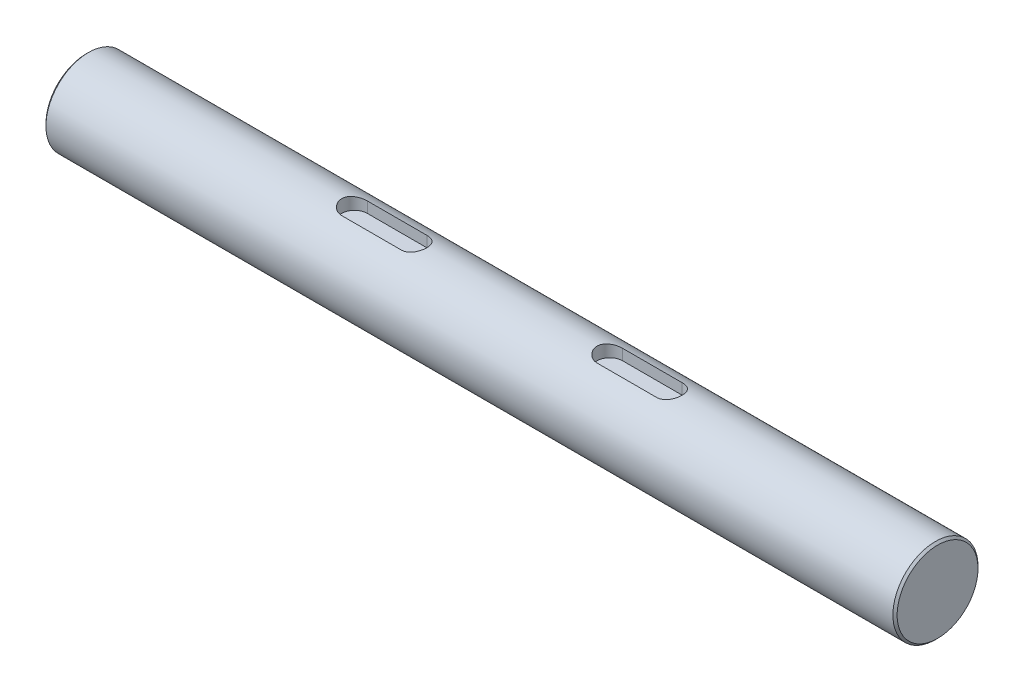
from build123d import *

# Parameters (mm, degrees)
SKETCH_1_R          = 10
EXTRUDE_1_DEPTH     = 100
CUT_EXTRUDE_1_DEPTH = 3
CHAMFER_1_SIZE      = 0.5
SKETCH_3_R          = 10
EXTRUDE_2_DEPTH     = 100
CUT_EXTRUDE_2_DEPTH = 3
CHAMFER_2_SIZE      = 0.5


with BuildPart() as part:
    # 草图1 → 凸台-拉伸1 (new body)
    with BuildSketch(Plane(origin=(0, 0, 0), x_dir=(0, 0, -1), z_dir=(1, 0, 0))):
        Circle(SKETCH_1_R)
    extrude(amount=EXTRUDE_1_DEPTH)

    # 草图2 → 切除-拉伸1 (cut)
    with BuildSketch(Plane(origin=(0, 10, 0), x_dir=(1, 0, 0), z_dir=(0, 1, 0))):
        with BuildLine():
            Line((63, 3), (77, 3))
            ThreePointArc((77, 3), (80, 0), (77, -3))
            Line((77, -3), (63, -3))
            ThreePointArc((63, -3), (60, 0), (63, 3))
        make_face()
    extrude(amount=-CUT_EXTRUDE_1_DEPTH, mode=Mode.SUBTRACT)

    # 倒角1
    chamfer_1_edges = [part.edges().sort_by_distance(p)[0] for p in [
        (0, 0, 10),
    ]]
    chamfer(chamfer_1_edges, length=CHAMFER_1_SIZE)

    # 草图3 → 凸台-拉伸2 (add)
    with BuildSketch(Plane(origin=(100, 0, 0), x_dir=(0, 0, -1), z_dir=(1, 0, 0))):
        Circle(SKETCH_3_R)
    extrude(amount=EXTRUDE_2_DEPTH)

    # 草图4 → 切除-拉伸2 (cut)
    with BuildSketch(Plane(origin=(0, 10, 0), x_dir=(1, 0, 0), z_dir=(0, 1, 0))):
        with BuildLine():
            Line((123, 3), (137, 3))
            ThreePointArc((137, 3), (140, 0), (137, -3))
            Line((137, -3), (123, -3))
            ThreePointArc((123, -3), (120, 0), (123, 3))
        make_face()
    extrude(amount=-CUT_EXTRUDE_2_DEPTH, mode=Mode.SUBTRACT)

    # 倒角2
    chamfer_2_edges = [part.edges().sort_by_distance(p)[0] for p in [
        (200, 0, 10),
    ]]
    chamfer(chamfer_2_edges, length=CHAMFER_2_SIZE)


solid = part.part
